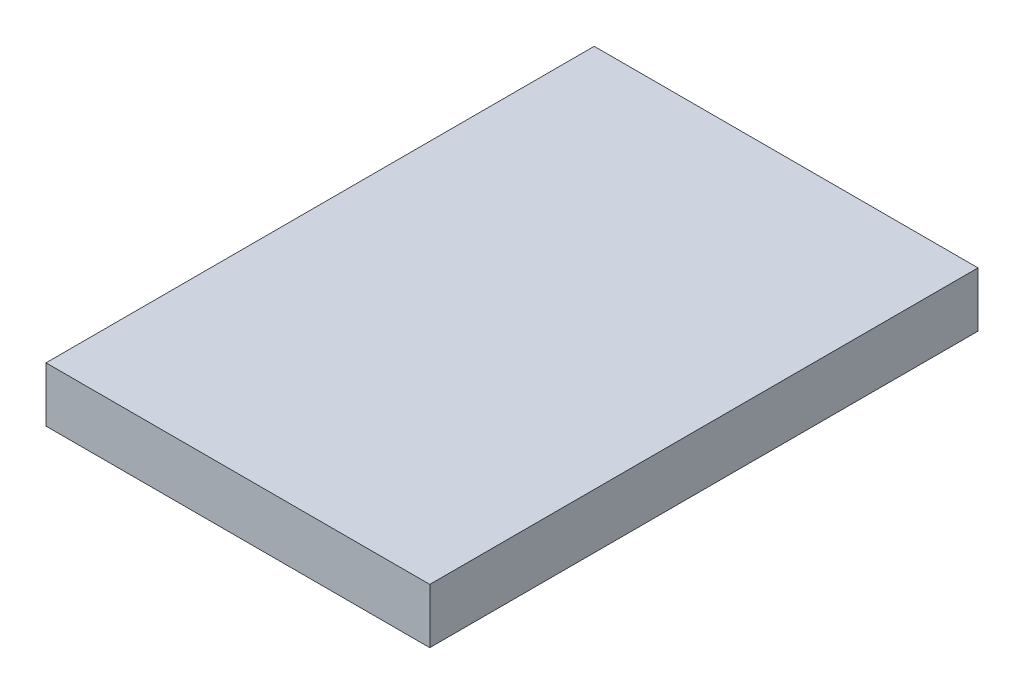
from build123d import *

# Parameters (mm, degrees)
SKETCH1_W           = 88.9
SKETCH1_H           = 127
BOSS_EXTRUDE1_DEPTH = 12.7


with BuildPart() as part:
    # Sketch1 → Boss-Extrude1 (new body)
    with BuildSketch(Plane(origin=(0, 0, 0), x_dir=(1, 0, 0), z_dir=(0, 1, 0))):
        with Locations((44.45, 63.5)):
            Rectangle(SKETCH1_W, SKETCH1_H)
    extrude(amount=BOSS_EXTRUDE1_DEPTH)


solid = part.part
